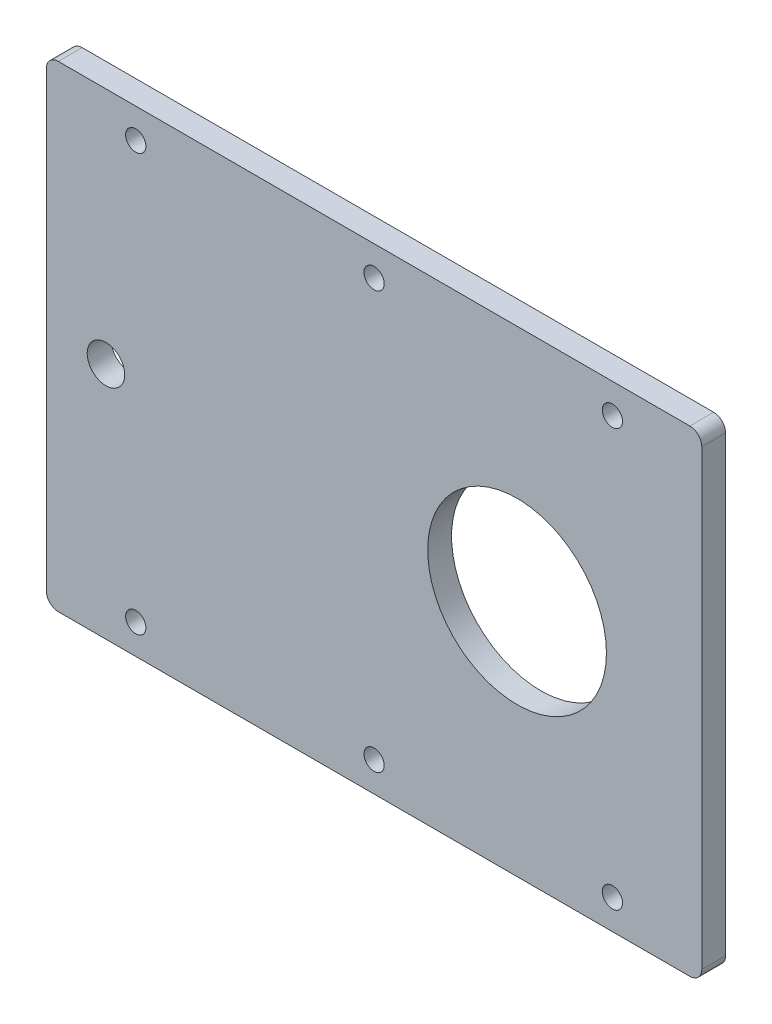
from build123d import *

# Parameters (mm, degrees)
SKETCH1_W           = 110
SKETCH1_H           = 80
SKETCH1_R           = 1.7
SKETCH1_R_2         = 3.15
SKETCH1_R_3         = 15
BOSS_EXTRUDE1_DEPTH = 4
FILLET1_R           = 2


with BuildPart() as part:
    # Sketch1 → Boss-Extrude1 (new body)
    with BuildSketch(Plane.XY):
        with Locations((53.890553518, -1.461144776)):
            Rectangle(SKETCH1_W, SKETCH1_H)
        with Locations((13.890553518, 33.538855224)):
            Circle(SKETCH1_R, mode=Mode.SUBTRACT)
        with Locations((93.890553518, 33.538855224)):
            Circle(SKETCH1_R, mode=Mode.SUBTRACT)
        with Locations((53.890553518, 33.538855224)):
            Circle(SKETCH1_R, mode=Mode.SUBTRACT)
        with Locations((13.890553518, -36.461144776)):
            Circle(SKETCH1_R, mode=Mode.SUBTRACT)
        with Locations((53.890553518, -36.461144776)):
            Circle(SKETCH1_R, mode=Mode.SUBTRACT)
        with Locations((93.890553518, -36.461144776)):
            Circle(SKETCH1_R, mode=Mode.SUBTRACT)
        with Locations((8.890553518, -1.461144776)):
            Circle(SKETCH1_R_2, mode=Mode.SUBTRACT)
        with Locations((77.890553518, -1.461144776)):
            Circle(SKETCH1_R_3, mode=Mode.SUBTRACT)
    extrude(amount=BOSS_EXTRUDE1_DEPTH)

    # Fillet1
    fillet1_edges = [part.edges().sort_by_distance(p)[0] for p in [
        (108.890553518, -41.461144776, 2),
        (-1.109446482, -41.461144776, 2),
        (-1.109446482, 38.538855224, 2),
        (108.890553518, 38.538855224, 2),
    ]]
    fillet(fillet1_edges, radius=FILLET1_R)


solid = part.part
